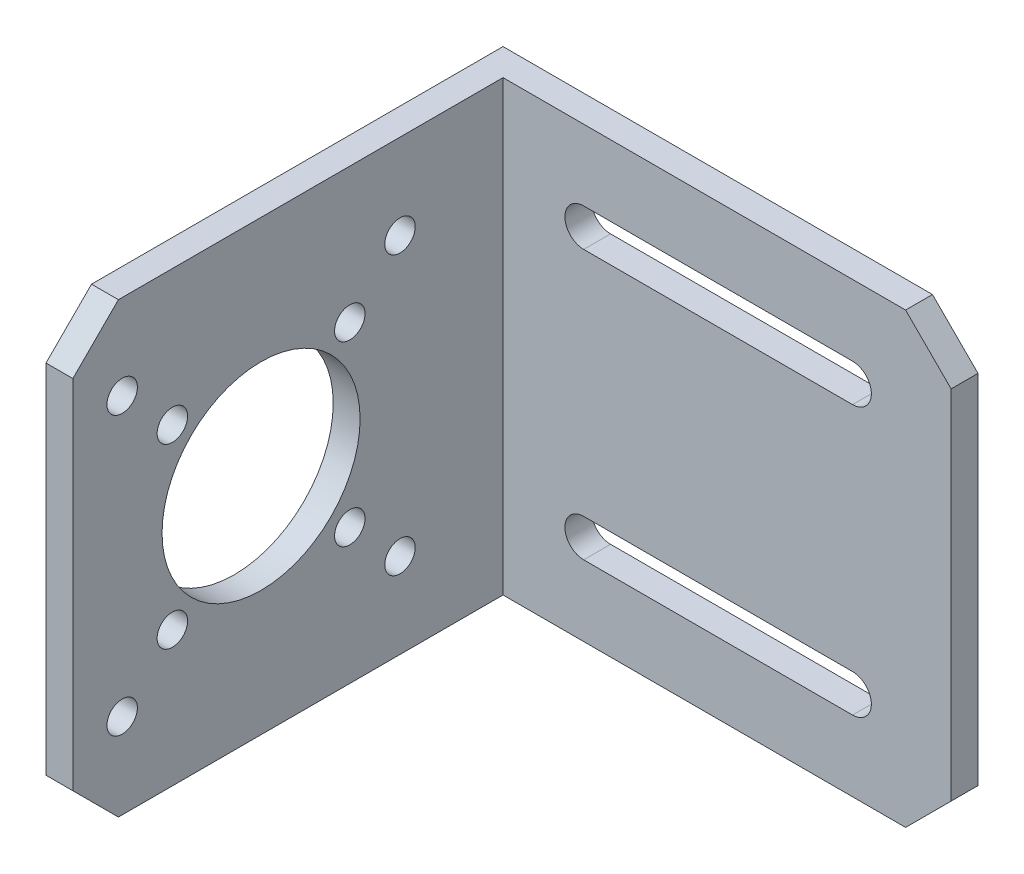
from build123d import *

# Parameters (mm, degrees)
SKETCH1_W            = 53
SKETCH1_H            = 50
BOSS_EXTRUDE1_DEPTH  = 3
CUT_EXTRUDE1_DEPTH   = 73.924618614
SKETCH3_W            = 3
SKETCH3_H            = 50
BOSS_EXTRUDE2_DEPTH  = 48
SKETCH4_R            = 11.05
CUT_EXTRUDE2_DEPTH   = 89.938180777
M3_CLEARANCE_HOLE1_D = 3.4
M3_CLEARANCE_HOLE2_D = 3.4
CHAMFER1_SIZE        = 5.08


with BuildPart() as part:
    # Sketch1 → Boss-Extrude1 (new body)
    with BuildSketch(Plane.XY):
        with Locations((26.5, 25)):
            Rectangle(SKETCH1_W, SKETCH1_H)
    extrude(amount=BOSS_EXTRUDE1_DEPTH)

    # Sketch2 → Cut-Extrude1 (cut, through all)
    with BuildSketch(Plane.XY.offset(3)):
        with BuildLine():
            Line((42, 37.9), (12, 37.9))
            ThreePointArc((12, 37.9), (9.9, 40), (12, 42.1))
            Line((12, 42.1), (42, 42.1))
            ThreePointArc((42, 42.1), (44.1, 40), (42, 37.9))
        make_face()
        with BuildLine():
            Line((42, 12.1), (12, 12.1))
            ThreePointArc((12, 12.1), (9.9, 10), (12, 7.9))
            Line((12, 7.9), (42, 7.9))
            ThreePointArc((42, 7.9), (44.1, 10), (42, 12.1))
        make_face()
    extrude(amount=-CUT_EXTRUDE1_DEPTH, mode=Mode.SUBTRACT)

    # Sketch3 → Boss-Extrude2 (add)
    with BuildSketch(Plane.XY.offset(3)):
        with Locations((1.5, 25)):
            Rectangle(SKETCH3_W, SKETCH3_H)
    extrude(amount=BOSS_EXTRUDE2_DEPTH)

    # Sketch4 → Cut-Extrude2 (cut, through all)
    with BuildSketch(Plane.ZY):
        with Locations((30, 25)):
            Circle(SKETCH4_R)
    extrude(amount=-CUT_EXTRUDE2_DEPTH, mode=Mode.SUBTRACT)

    # M3 Clearance Hole1 (through all)
    with Locations(Plane.ZY):
        with Locations((45.5, 9.5), (14.5, 40.5), (14.5, 9.5), (45.5, 40.5)):
            Hole(M3_CLEARANCE_HOLE1_D / 2)

    # M3 Clearance Hole2 (through all)
    with Locations(Plane.ZY):
        with Locations((39.899494937, 34.899494937), (39.899494937, 15.100505063), (20.100505063, 34.899494937), (20.100505063, 15.100505063)):
            Hole(M3_CLEARANCE_HOLE2_D / 2)

    # Chamfer1
    chamfer1_edges = [part.edges().sort_by_distance(p)[0] for p in [
        (1.5, 0, 51),
        (1.5, 50, 51),
        (53, 50, 1.5),
        (53, 0, 1.5),
    ]]
    chamfer(chamfer1_edges, length=CHAMFER1_SIZE)


solid = part.part
